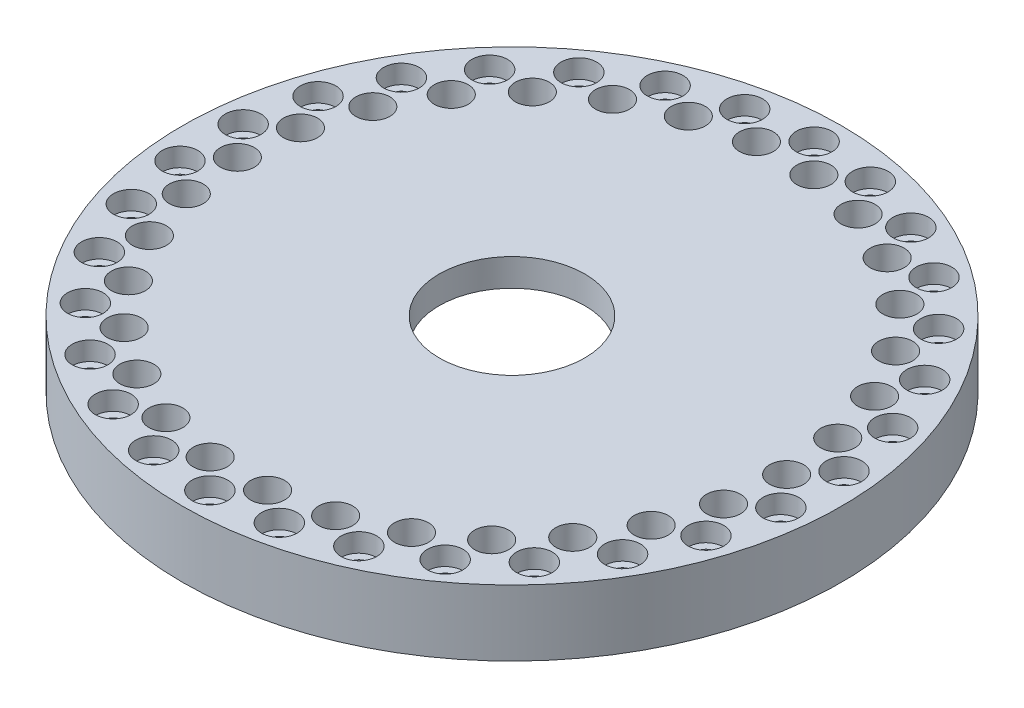
from build123d import *

# Parameters (mm, degrees)
SKETCH1_R                                           = 60
SKETCH1_R_2                                         = 13.25
BOSS_EXTRUDE1_DEPTH                                 = 12
CBORE_FOR_M3_HEX_SOCKET_HEAD_CAP_SCREW1_D           = 3.6
CBORE_FOR_M3_HEX_SOCKET_HEAD_CAP_SCREW1_CBORE_D     = 6.5
CBORE_FOR_M3_HEX_SOCKET_HEAD_CAP_SCREW1_CBORE_DEPTH = 3.4
F_6_2_6_2_DIAMETER_HOLE1_D                          = 6.2
SKETCH7_R                                           = 23.5
CUT_EXTRUDE1_DEPTH                                  = 7
BOSS_EXTRUDE2_START                                 = 0.6
SKETCH8_R                                           = 23.5
SKETCH8_R_2                                         = 19.5
BOSS_EXTRUDE2_DEPTH                                 = 0.6
SKETCH9_R                                           = 0.75
CIRPATTERN2_COUNT                                   = 30


with BuildPart() as part:
    # Sketch1 → Boss-Extrude1 (new body)
    with BuildSketch(Plane(origin=(0, 0, 0), x_dir=(1, 0, 0), z_dir=(0, 1, 0))):
        with Locations(Location((0, 0, 0), (0, 0, 270))):
            Circle(SKETCH1_R)
        with Locations(Location((0, 0, 0), (0, 0, 270))):
            Circle(SKETCH1_R_2, mode=Mode.SUBTRACT)
    extrude(amount=BOSS_EXTRUDE1_DEPTH)

    # CBORE for M3 Hex Socket Head Cap Screw1 (through all)
    with Locations(Plane(origin=(0, 12, 0), x_dir=(1, 0, 0), z_dir=(0, 1, 0))):
        with Locations((0, 55), (11.435142995, 53.79811804), (22.370515369, 50.24500017), (32.328188876, 44.495934691), (40.872965401, 36.80218335), (47.631397208, 27.5), (52.308108396, 16.995934691), (54.698704245, 5.74906548), (54.698704245, -5.74906548), (52.308108396, -16.995934691), (47.631397208, -27.5), (40.872965401, -36.80218335), (32.328188876, -44.495934691), (22.370515369, -50.24500017), (11.435142995, -53.79811804), (0, -55), (-11.435142995, -53.79811804), (-22.370515369, -50.24500017), (-32.328188876, -44.495934691), (-40.872965401, -36.80218335), (-47.631397208, -27.5), (-52.308108396, -16.995934691), (-54.698704245, -5.74906548), (-54.698704245, 5.74906548), (-52.308108396, 16.995934691), (-47.631397208, 27.5), (-40.872965401, 36.80218335), (-32.328188876, 44.495934691), (-22.370515369, 50.24500017), (-11.435142995, 53.79811804)):
            CounterBoreHole(CBORE_FOR_M3_HEX_SOCKET_HEAD_CAP_SCREW1_D / 2, CBORE_FOR_M3_HEX_SOCKET_HEAD_CAP_SCREW1_CBORE_D / 2, CBORE_FOR_M3_HEX_SOCKET_HEAD_CAP_SCREW1_CBORE_DEPTH)

    # Ø6.2 (6.2) Diameter Hole1 (through all)
    with Locations(Plane(origin=(0, 0, 0), x_dir=(-1, 0, 0), z_dir=(0, -1, 0))):
        with Locations((-15.450849719, 47.552825815), (-5.226423163, 49.726094768), (5.226423163, 49.726094768), (15.450849719, 47.552825815), (25, 43.301270189), (33.456530318, 37.157241274), (40.450849719, 29.389262615), (45.677272882, 20.336832154), (48.907380037, 10.395584541), (50, 0), (48.907380037, -10.395584541), (45.677272882, -20.336832154), (40.450849719, -29.389262615), (33.456530318, -37.157241274), (25, -43.301270189), (15.450849719, -47.552825815), (5.226423163, -49.726094768), (-5.226423163, -49.726094768), (-15.450849719, -47.552825815), (-25, -43.301270189), (-33.456530318, -37.157241274), (-40.450849719, -29.389262615), (-45.677272882, -20.336832154), (-48.907380037, -10.395584541), (-50, 0), (-48.907380037, 10.395584541), (-45.677272882, 20.336832154), (-40.450849719, 29.389262615), (-33.456530318, 37.157241274), (-25, 43.301270189)):
            Hole(F_6_2_6_2_DIAMETER_HOLE1_D / 2)

    # Sketch7 → Cut-Extrude1 (cut)
    with BuildSketch(Plane.XZ):
        with Locations(Location((0, 0, 0), (0, 0, 270))):
            Circle(SKETCH7_R)
    extrude(amount=-CUT_EXTRUDE1_DEPTH, mode=Mode.SUBTRACT)

    # Sketch8 → Boss-Extrude2 (add)
    with BuildSketch(Plane.XZ.offset(-7).offset(BOSS_EXTRUDE2_START)):
        with Locations(Location((0, 0, 0), (0, 0, 270))):
            Circle(SKETCH8_R)
        with Locations(Location((0, 0, 0), (0, 0, 270))):
            Circle(SKETCH8_R_2, mode=Mode.SUBTRACT)
    extrude(amount=-BOSS_EXTRUDE2_DEPTH)

    # Sketch9 → Cut-Revolve1 (revolve, cut)
    with BuildSketch(Plane.XY, mode=Mode.PRIVATE) as cut_revolve1_sk:
        with Locations((-23.5, 6.4)):
            Circle(SKETCH9_R)
    revolve(cut_revolve1_sk.sketch.rotate(Axis((0, 12, 0), (0, -1, 0)), 90), axis=Axis((0, 12, 0), (0, -1, 0)), mode=Mode.SUBTRACT)

    # Sketch10 → Cut-Revolve2 (revolve, cut)
    with BuildSketch(Plane.XY, mode=Mode.PRIVATE) as cut_revolve2_sk:
        Polygon((-46.9, 0), (-46.9, 1), (-45.9, 0), align=None)
    cut_revolve2 = revolve(cut_revolve2_sk.sketch.rotate(Axis((-50, 12, 0), (0, -1, 0)), 270), axis=Axis((-50, 12, 0), (0, -1, 0)), mode=Mode.SUBTRACT)

    # CirPattern2: Cut-Revolve2 ×30 about axis
    cirpattern2_axis = Axis((0, 0, 0), (0, 1, 0))
    for i in range(1, CIRPATTERN2_COUNT):
        add(cut_revolve2.rotate(cirpattern2_axis, i * 360 / CIRPATTERN2_COUNT), mode=Mode.SUBTRACT)


solid = part.part
